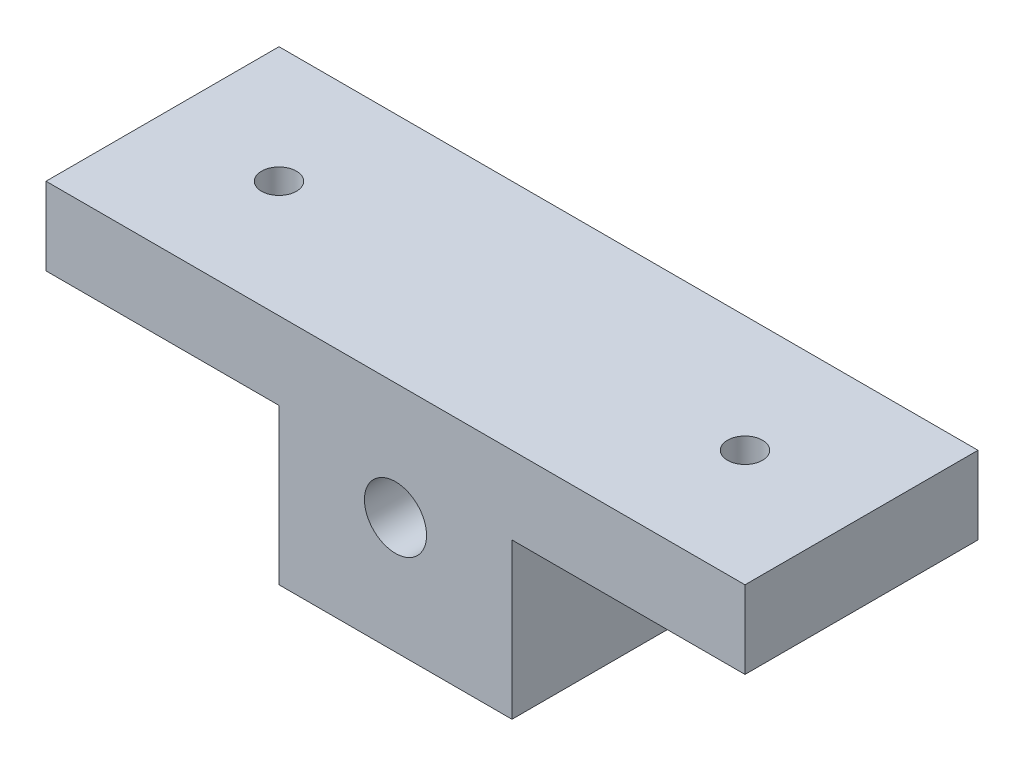
from build123d import *

# Parameters (mm, degrees)
SKETCH_1_W                   = 30
SKETCH_1_H                   = 30
EXTRUDE_1_DEPTH              = 30
SKETCH_2_R                   = 4
CUT_EXTRUDE_1_DEPTH          = 30
SKETCH_3_W                   = 30
SKETCH_3_H                   = 10
EXTRUDE_2_DEPTH              = 30
SKETCH_4_W                   = 30
SKETCH_4_H                   = 10
EXTRUDE_3_DEPTH              = 30
HOLE_WIZARD_M4_1_D           = 4.5
HOLE_WIZARD_M4_1_CBORE_D     = 10
HOLE_WIZARD_M4_1_CBORE_DEPTH = 4


with BuildPart() as part:
    # 스케치1 → 보스-돌출1 (new body)
    with BuildSketch(Plane.XY):
        Rectangle(SKETCH_1_W, SKETCH_1_H)
    extrude(amount=EXTRUDE_1_DEPTH)

    # 스케치2 → 컷-돌출1 (cut)
    with BuildSketch(Plane.XY.offset(30)):
        Circle(SKETCH_2_R)
    extrude(amount=-CUT_EXTRUDE_1_DEPTH, mode=Mode.SUBTRACT)

    # 스케치3 → 보스-돌출2 (add)
    with BuildSketch(Plane(origin=(15, 0, 0), x_dir=(0, 0, -1), z_dir=(1, 0, 0))):
        with Locations((-15, 10)):
            Rectangle(SKETCH_3_W, SKETCH_3_H)
    extrude(amount=EXTRUDE_2_DEPTH)

    # 스케치4 → 보스-돌출3 (add)
    with BuildSketch(Plane.ZY.offset(15)):
        with Locations((15, 10)):
            Rectangle(SKETCH_4_W, SKETCH_4_H)
    extrude(amount=EXTRUDE_3_DEPTH)

    # M4 소켓 머리 캡 나사용 카운터보어1 (through all)
    with Locations(Plane(origin=(0, 5, 0), x_dir=(-1, 0, 0), z_dir=(0, -1, 0))):
        with Locations((-30, -15), (30, -15)):
            CounterBoreHole(HOLE_WIZARD_M4_1_D / 2, HOLE_WIZARD_M4_1_CBORE_D / 2, HOLE_WIZARD_M4_1_CBORE_DEPTH)


solid = part.part
